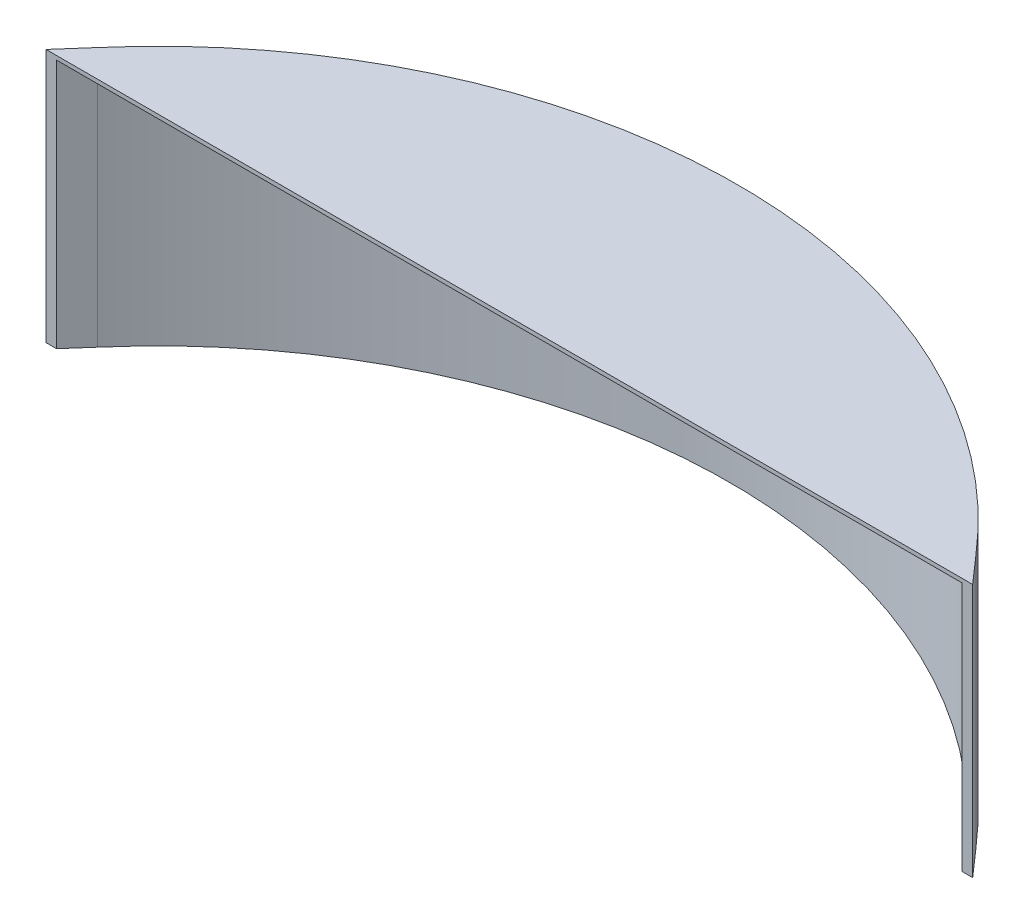
from build123d import *

# Parameters (mm, degrees)
BOSS_EXTRUDE1_DEPTH = 1
BOSS_EXTRUDE2_START = 63.399999946
BOSS_EXTRUDE2_DEPTH = 63.399999946


with BuildPart() as part:
    # Sketch3 → Boss-Extrude1 (new body)
    with BuildSketch(Plane(origin=(0, 0, 0), x_dir=(1, 0, 0), z_dir=(0, 1, 0))):
        with BuildLine():
            Line((-117.504462868, 326.155640462), (-111.509184915, 332.971148344))
            ThreePointArc((-111.509184915, 332.971148344), (0, 384.155640476), (111.509184915, 332.971148344))
            Line((111.509184915, 332.971148344), (117.504462868, 326.155640462))
            Line((117.504462868, 326.155640462), (-117.504462868, 326.155640462))
        make_face()
    extrude(amount=BOSS_EXTRUDE1_DEPTH)

    # Sketch4 → Boss-Extrude2 (add)
    with BuildSketch(Plane.XZ.offset(BOSS_EXTRUDE2_START)):
        with BuildLine():
            Line((-117.504462868, -326.155640462), (-111.509184915, -332.971148344))
            ThreePointArc((-111.509184915, -332.971148344), (0, -384.155640476), (111.509184915, -332.971148344))
            Line((111.509184915, -332.971148344), (117.504462868, -326.155640462))
            Line((117.504462868, -326.155640462), (114.84078994, -326.155640462))
            Line((114.84078994, -326.155640462), (110, -331.658711753))
            ThreePointArc((110, -331.658711753), (0, -382.155640476), (-110, -331.658711753))
            Line((-110, -331.658711753), (-114.84078994, -326.155640462))
            Line((-114.84078994, -326.155640462), (-117.504462868, -326.155640462))
        make_face()
    extrude(amount=-BOSS_EXTRUDE2_DEPTH)


solid = part.part
